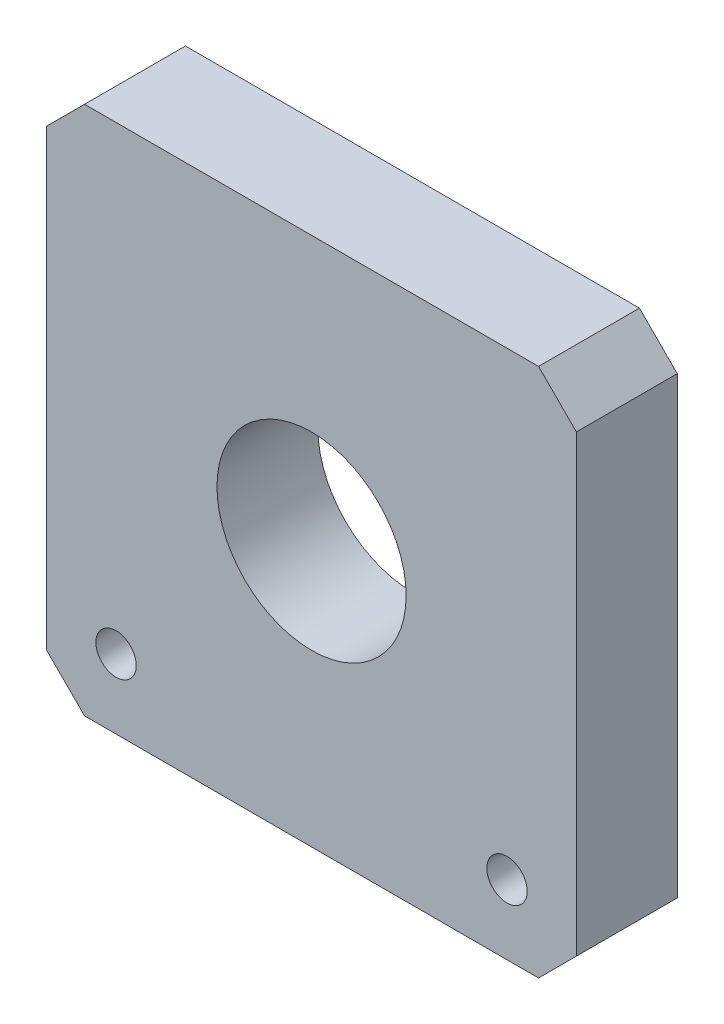
from build123d import *

# Parameters (mm, degrees)
SKETCH1_W           = 42
SKETCH1_H           = 42
BOSS_EXTRUDE1_DEPTH = 8
SKETCH2_R           = 1.6
SKETCH2_R_2         = 7.5
CUT_EXTRUDE1_DEPTH  = 9
CHAMFER1_SIZE       = 3


with BuildPart() as part:
    # Sketch1 → Boss-Extrude1 (new body)
    with BuildSketch(Plane.XY):
        with Locations((21, 21)):
            Rectangle(SKETCH1_W, SKETCH1_H)
    extrude(amount=BOSS_EXTRUDE1_DEPTH)

    # Sketch2 → Cut-Extrude1 (cut)
    with BuildSketch(Plane.XY.offset(8)):
        with Locations((36.5, 5.5)):
            Circle(SKETCH2_R)
        with Locations((5.5, 5.5)):
            Circle(SKETCH2_R)
        with Locations((21, 21)):
            Circle(SKETCH2_R_2)
    extrude(amount=-CUT_EXTRUDE1_DEPTH, mode=Mode.SUBTRACT)

    # Chamfer1
    chamfer1_edges = [part.edges().sort_by_distance(p)[0] for p in [
        (0, 42, 4),
        (42, 42, 4),
        (42, 0, 4),
        (0, 0, 4),
    ]]
    chamfer(chamfer1_edges, length=CHAMFER1_SIZE)


solid = part.part
